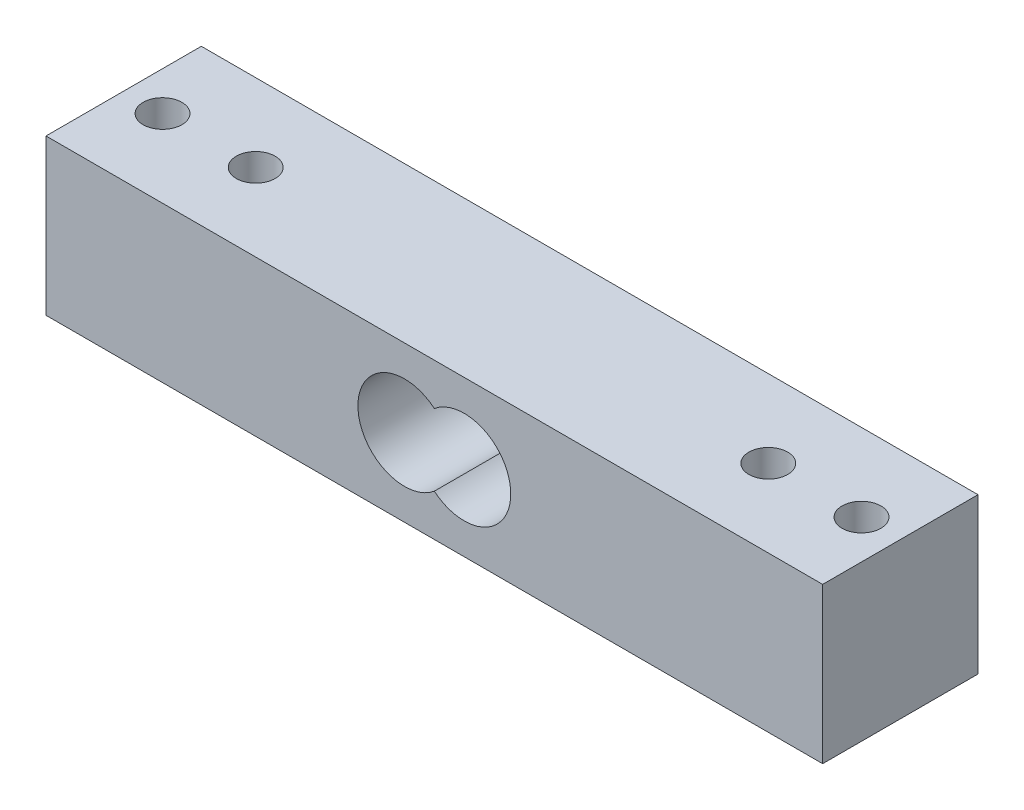
from build123d import *

# Parameters (mm, degrees)
CROQUIS1_W                                 = 50
CROQUIS1_H                                 = 10
SALIENTE_EXTRUIR1_DEPTH                    = 10
PERFORADOR_PARA_ROSCAR_PARA_MACHO_DE_ROS_D = 2.5
PERFORADOR_PARA_ROSCAR_PARA_MACHO_DE_2_D   = 2.5


with BuildPart() as part:
    # Croquis1 → Saliente-Extruir1 (new body)
    with BuildSketch(Plane.XY):
        Rectangle(CROQUIS1_W, CROQUIS1_H)
        with BuildLine():
            ThreePointArc((0, 2.304727813), (-4.920476427, 0), (0, -2.304727813))
            ThreePointArc((0, -2.304727813), (4.920476427, 0), (0, 2.304727813))
        make_face(mode=Mode.SUBTRACT)
    extrude(amount=SALIENTE_EXTRUIR1_DEPTH)

    # Perforador para roscar para macho de ros (through all)
    with Locations(Plane(origin=(0, 5, 0), x_dir=(1, 0, 0), z_dir=(0, 1, 0))):
        with Locations((-22.5, -5), (-16.5, -5)):
            Hole(PERFORADOR_PARA_ROSCAR_PARA_MACHO_DE_ROS_D / 2)

    # Perforador para roscar para macho de 2 (through all)
    with Locations(Plane(origin=(0, 5, 0), x_dir=(1, 0, 0), z_dir=(0, 1, 0))):
        with Locations((22.5, -5), (16.5, -5)):
            Hole(PERFORADOR_PARA_ROSCAR_PARA_MACHO_DE_2_D / 2)


solid = part.part
